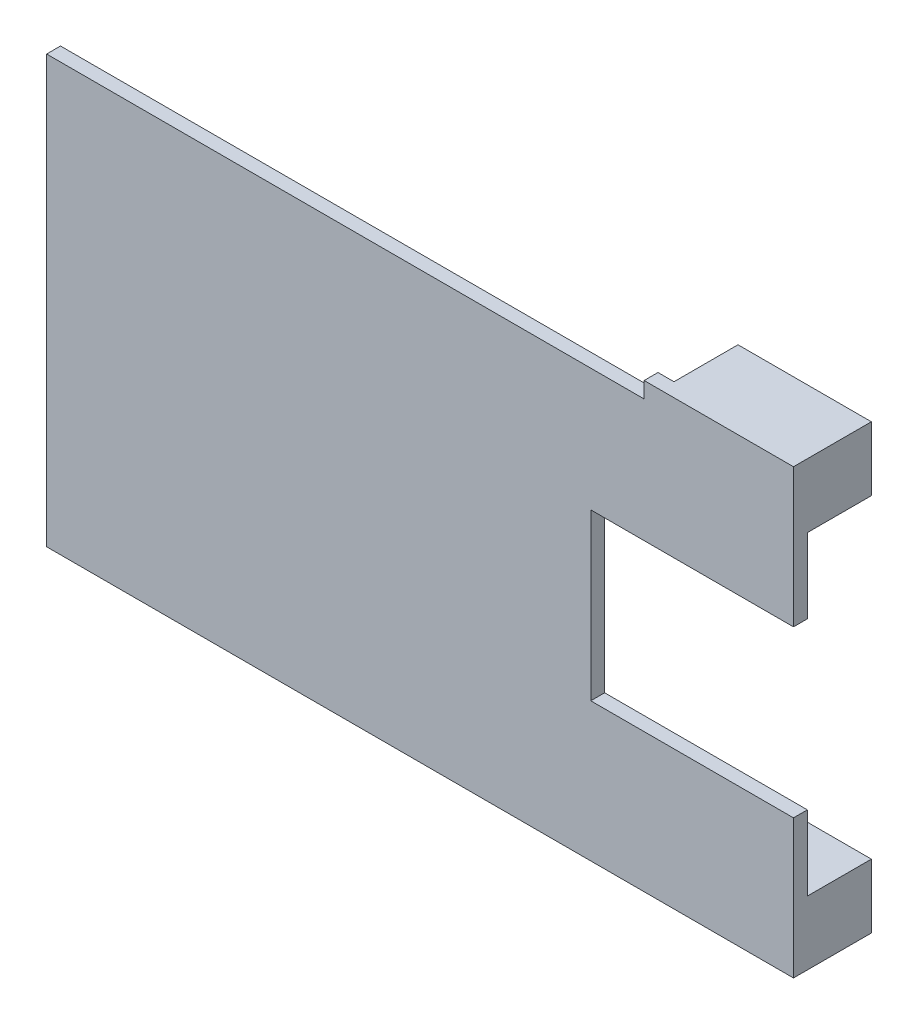
from build123d import *

# Parameters (mm, degrees)
SKETCH2_W           = 70
SKETCH2_H           = 40
BOSS_EXTRUDE1_DEPTH = 1.3
SKETCH4_W           = 14
SKETCH4_H           = 1.3
BOSS_EXTRUDE3_DEPTH = 1.5
SKETCH8_W           = 12.5
SKETCH8_H           = 6
BOSS_EXTRUDE4_DEPTH = 6
SKETCH9_W           = 1
SKETCH9_H           = 2.3
BOSS_EXTRUDE5_DEPTH = 0.8
SKETCH6_W           = 19
SKETCH6_H           = 15.5
CUT_EXTRUDE1_DEPTH  = 1.3


with BuildPart() as part:
    # Sketch2 → Boss-Extrude1 (new body)
    with BuildSketch(Plane.XY):
        with Locations((35, 20)):
            Rectangle(SKETCH2_W, SKETCH2_H)
    extrude(amount=BOSS_EXTRUDE1_DEPTH)

    # Sketch4 → Boss-Extrude3 (add)
    with BuildSketch(Plane(origin=(0, 40, 0), x_dir=(1, 0, 0), z_dir=(0, 1, 0))):
        with Locations((63, -0.65)):
            Rectangle(SKETCH4_W, SKETCH4_H)
    extrude(amount=BOSS_EXTRUDE3_DEPTH)

    # Sketch8 → Boss-Extrude4 (add)
    with BuildSketch(Plane(origin=(0, 0, 0), x_dir=(-1, 0, 0), z_dir=(0, 0, -1))):
        with Locations((-63.75, 38.5)):
            Rectangle(SKETCH8_W, SKETCH8_H)
        with Locations((-63.75, 3)):
            Rectangle(SKETCH8_W, SKETCH8_H)
    extrude(amount=BOSS_EXTRUDE4_DEPTH)

    # Sketch9 → Boss-Extrude5 (add)
    with BuildSketch(Plane(origin=(0, 0, -6), x_dir=(-1, 0, 0), z_dir=(0, 0, -1))):
        with Locations((-66, 38.5)):
            Rectangle(SKETCH9_W, SKETCH9_H)
        with Locations((-66, 3)):
            Rectangle(SKETCH9_W, SKETCH9_H)
    extrude(amount=BOSS_EXTRUDE5_DEPTH)

    # Sketch6 → Cut-Extrude1 (cut)
    with BuildSketch(Plane.XY.offset(1.3)):
        with Locations((60.5, 20.75)):
            Rectangle(SKETCH6_W, SKETCH6_H)
    extrude(amount=-CUT_EXTRUDE1_DEPTH, mode=Mode.SUBTRACT)


solid = part.part
